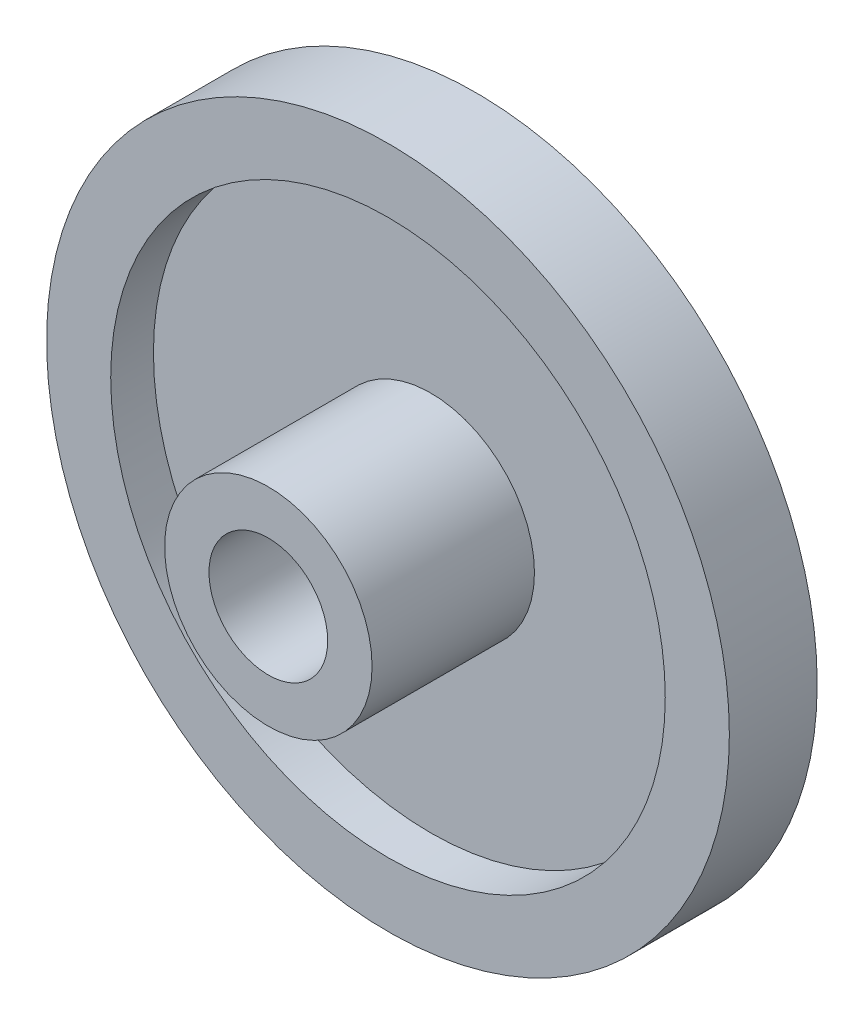
from build123d import *


with BuildPart() as part:
    # Sketch2 → Revolve1 (revolve)
    with BuildSketch(Plane(origin=(0, 0, 0), x_dir=(0, 0, -1), z_dir=(1, 0, 0)), mode=Mode.PRIVATE) as revolve1_sk:
        Polygon((0, 18.2626), (-4.699, 18.2626), (-4.699, 14.8336), (-2.413, 14.8336), (-2.413, 5.5499), (-11.0998, 5.5499), (-11.0998, 3.175), (0, 3.175), align=None)
    revolve(revolve1_sk.sketch.rotate(Axis((0, 0, 114.884635091), (0, 0, -1)), 90), axis=Axis((0, 0, 114.884635091), (0, 0, -1)))


solid = part.part
